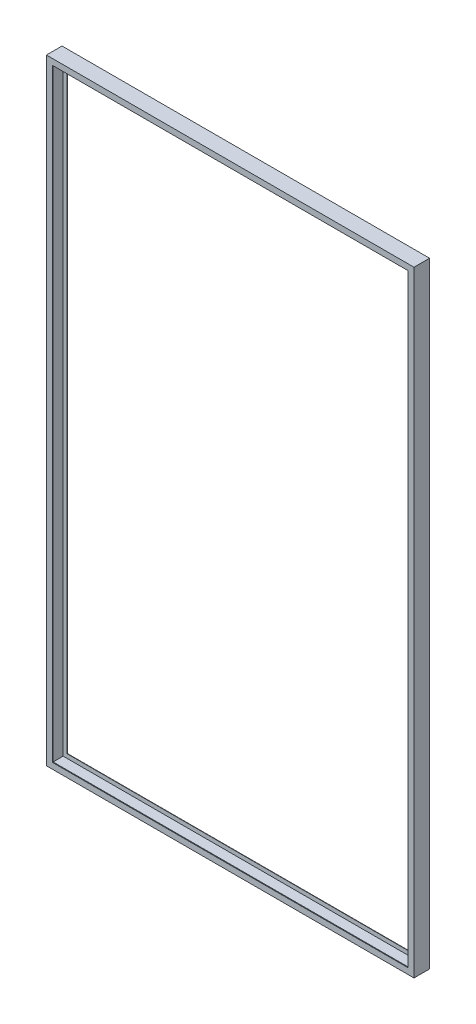
from build123d import *
from OCP.BRepFilletAPI import BRepFilletAPI_MakeChamfer

# Parameters (mm, degrees)
SKETCH1_W           = 990
SKETCH1_H           = 1658
BOSS_EXTRUDE1_DEPTH = 42
SKETCH2_W           = 958
SKETCH2_H           = 1626
CUT_EXTRUDE1_DEPTH  = 2
SKETCH3_W           = 968
SKETCH3_H           = 1636
CUT_EXTRUDE2_DEPTH  = 1932.492687017
SKETCH4_W           = 968
SKETCH4_H           = 1636
SKETCH4_W_2         = 946
SKETCH4_H_2         = 1614
BOSS_EXTRUDE2_DEPTH = 1
CUT_EXTRUDE3_START  = -4
SKETCH5_W           = 980
SKETCH5_H           = 1648
CUT_EXTRUDE3_DEPTH  = 3
CHAMFER1_SIZE       = 3
CHAMFER1_SIZE2      = 5.196152423


with BuildPart() as part:
    # Sketch1 → Boss-Extrude1 (new body)
    with BuildSketch(Plane.XY):
        with Locations((495, 829)):
            Rectangle(SKETCH1_W, SKETCH1_H)
    extrude(amount=BOSS_EXTRUDE1_DEPTH)

    # Sketch2 → Cut-Extrude1 (cut)
    with BuildSketch(Plane.XY.offset(42)):
        with Locations((495, 829)):
            Rectangle(SKETCH2_W, SKETCH2_H)
    extrude(amount=-CUT_EXTRUDE1_DEPTH, mode=Mode.SUBTRACT)

    # Sketch3 → Cut-Extrude2 (cut, through all)
    with BuildSketch(Plane.XY.offset(40)):
        with Locations((495, 829)):
            Rectangle(SKETCH3_W, SKETCH3_H)
    extrude(amount=-CUT_EXTRUDE2_DEPTH, mode=Mode.SUBTRACT)

    # Sketch4 → Boss-Extrude2 (add)
    with BuildSketch(Plane.XY.offset(7)):
        with Locations((495, 829)):
            Rectangle(SKETCH4_W, SKETCH4_H)
        with Locations((495, 829)):
            Rectangle(SKETCH4_W_2, SKETCH4_H_2, mode=Mode.SUBTRACT)
    extrude(amount=BOSS_EXTRUDE2_DEPTH)

    # Sketch5 → Cut-Extrude3 (cut)
    with BuildSketch(Plane(origin=(0, 0, 0), x_dir=(-1, 0, 0), z_dir=(0, 0, -1)).offset(CUT_EXTRUDE3_START)):
        with Locations((-495, 829)):
            Rectangle(SKETCH5_W, SKETCH5_H)
    extrude(amount=-CUT_EXTRUDE3_DEPTH, mode=Mode.SUBTRACT)

    # Chamfer1: one chamfer whose edges measure the first distance from different faces: ONE call of the kernel's chamfer builder (chamfer() names one face for all edges)
    chamfer1_edges_1 = [part.edges().sort_by_distance(p)[0] for p in [
        (495, 1647, 0),
    ]]
    chamfer1_side_1 = [part.faces().sort_by_distance(p)[0] for p in [
        (495, 1647, 2),
    ]]
    chamfer1_edges_2 = [part.edges().sort_by_distance(p)[0] for p in [
        (979, 829, 0),
    ]]
    chamfer1_side_2 = [part.faces().sort_by_distance(p)[0] for p in [
        (979, 829, 2),
    ]]
    chamfer1_edges_3 = [part.edges().sort_by_distance(p)[0] for p in [
        (495, 11, 0),
    ]]
    chamfer1_side_3 = [part.faces().sort_by_distance(p)[0] for p in [
        (495, 11, 2),
    ]]
    chamfer1_edges_4 = [part.edges().sort_by_distance(p)[0] for p in [
        (11, 829, 0),
    ]]
    chamfer1_side_4 = [part.faces().sort_by_distance(p)[0] for p in [
        (11, 829, 2),
    ]]
    chamfer1 = BRepFilletAPI_MakeChamfer(part.part.solid().wrapped)
    for e in chamfer1_edges_1:
        chamfer1.Add(CHAMFER1_SIZE, CHAMFER1_SIZE2, e.wrapped, chamfer1_side_1[0].wrapped)  # the first distance lies on this face
    for e in chamfer1_edges_2:
        chamfer1.Add(CHAMFER1_SIZE, CHAMFER1_SIZE2, e.wrapped, chamfer1_side_2[0].wrapped)  # the first distance lies on this face
    for e in chamfer1_edges_3:
        chamfer1.Add(CHAMFER1_SIZE, CHAMFER1_SIZE2, e.wrapped, chamfer1_side_3[0].wrapped)  # the first distance lies on this face
    for e in chamfer1_edges_4:
        chamfer1.Add(CHAMFER1_SIZE, CHAMFER1_SIZE2, e.wrapped, chamfer1_side_4[0].wrapped)  # the first distance lies on this face
    add(Compound.cast(chamfer1.Shape()), mode=Mode.REPLACE)


solid = part.part
